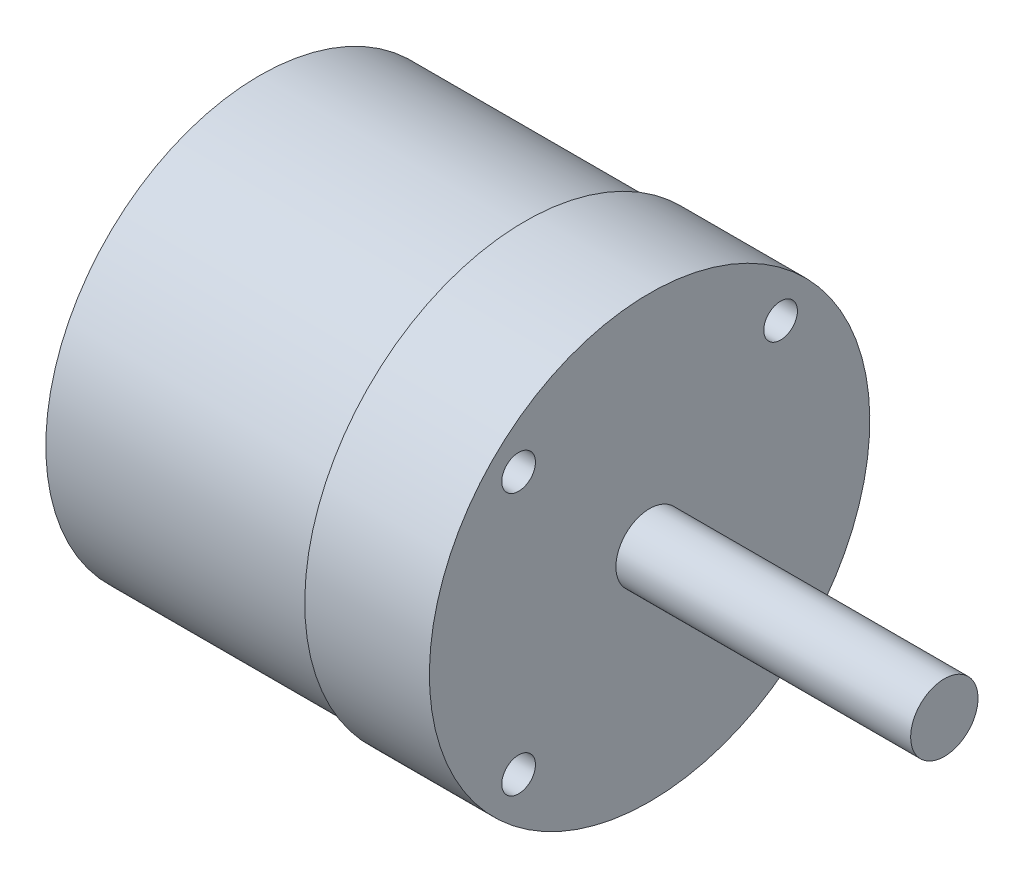
from build123d import *

# Parameters (mm, degrees)
SKETCH3_R          = 2
CUT_EXTRUDE1_DEPTH = 10
CUT_EXTRUDE2_DEPTH = 2


with BuildPart() as part:
    # Sketch2 → Revolve1 (revolve)
    with BuildSketch(Plane.XY, mode=Mode.PRIVATE) as revolve1_sk:
        Polygon((-54.3, 0), (-54.3, 5), (-52.3, 5), (-52.3, 7.5), (-46.3, 7.5), (-46.3, 25.4), (-14.8, 25.4), (-14.8, 26.15), (0, 26.15), (0, 4), (35, 4), (35, 0), align=None)
    revolve(revolve1_sk.sketch.rotate(Axis((-163.925373134, 0, 0), (1, 0, 0)), 180), axis=Axis((-163.925373134, 0, 0), (1, 0, 0)))

    # Sketch3 → Cut-Extrude1 (cut)
    with BuildSketch(Plane(origin=(0, 0, 0), x_dir=(0, 0, -1), z_dir=(1, 0, 0))):
        with Locations(Location((-15.556349186, -15.556349186, 0), (0, 0, 90))):
            Circle(SKETCH3_R)
        with Locations(Location((-15.556349186, 15.556349186, 0), (0, 0, 90))):
            Circle(SKETCH3_R)
        with Locations(Location((15.556349186, 15.556349186, 0), (0, 0, 90))):
            Circle(SKETCH3_R)
        with Locations(Location((15.556349186, -15.556349186, 0), (0, 0, 90))):
            Circle(SKETCH3_R)
    extrude(amount=-CUT_EXTRUDE1_DEPTH, mode=Mode.SUBTRACT)

    # Sketch5 → Cut-Extrude2 (cut)
    with BuildSketch(Plane(origin=(0, -4, 0), x_dir=(-1, 0, 0), z_dir=(0, -1, 0))):
        with BuildLine():
            Line((-12.5, -1.5), (-17.5, -1.5))
            ThreePointArc((-17.5, -1.5), (-19, 0), (-17.5, 1.5))
            Line((-17.5, 1.5), (-12.5, 1.5))
            ThreePointArc((-12.5, 1.5), (-11, 0), (-12.5, -1.5))
        make_face()
    extrude(amount=-CUT_EXTRUDE2_DEPTH, mode=Mode.SUBTRACT)


solid = part.part
